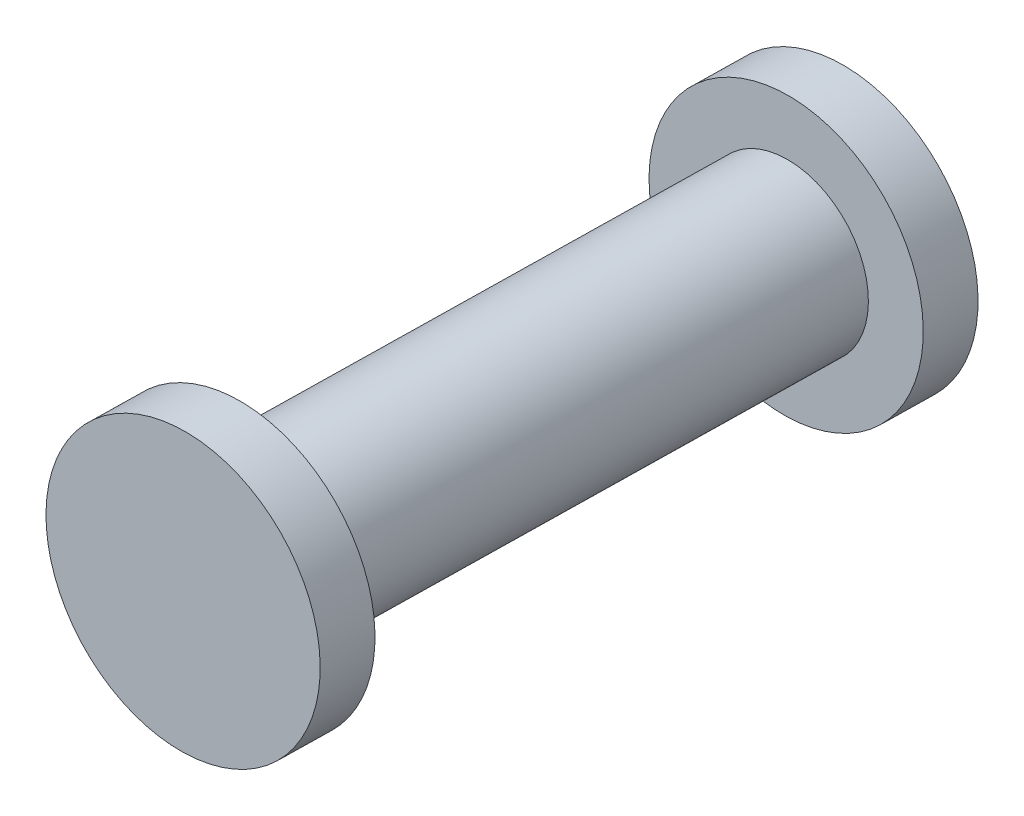
from build123d import *

# Parameters (mm, degrees)
BODY_MOVE_COPY1_ANGLE = 119.424338974


with BuildPart() as part:
    # Sketch1 → Revolve1 (revolve)
    with BuildSketch(Plane.XY, mode=Mode.PRIVATE) as revolve1_sk:
        Polygon((0, 0), (0, 12), (-2.5, 12), (-2.5, 11), (-1.5, 11), (-1.5, 1), (-2.5, 1), (-2.5, 0), align=None)
    revolve(revolve1_sk.sketch.rotate(Axis((0, 0, 0), (0, 1, 0)), 270), axis=Axis((0, 0, 0), (0, 1, 0)))


with BuildPart() as part_1:
    # Body-Move/Copy1: moved
    add(part.part.moved(Location((0, 0, 0))).rotate(Axis((-2.346629399, 4.612052575, -2.346629399), (0.5739619558891293, 0.5840679295973761, 0.5739619558888548)), BODY_MOVE_COPY1_ANGLE))


solid = part_1.part
